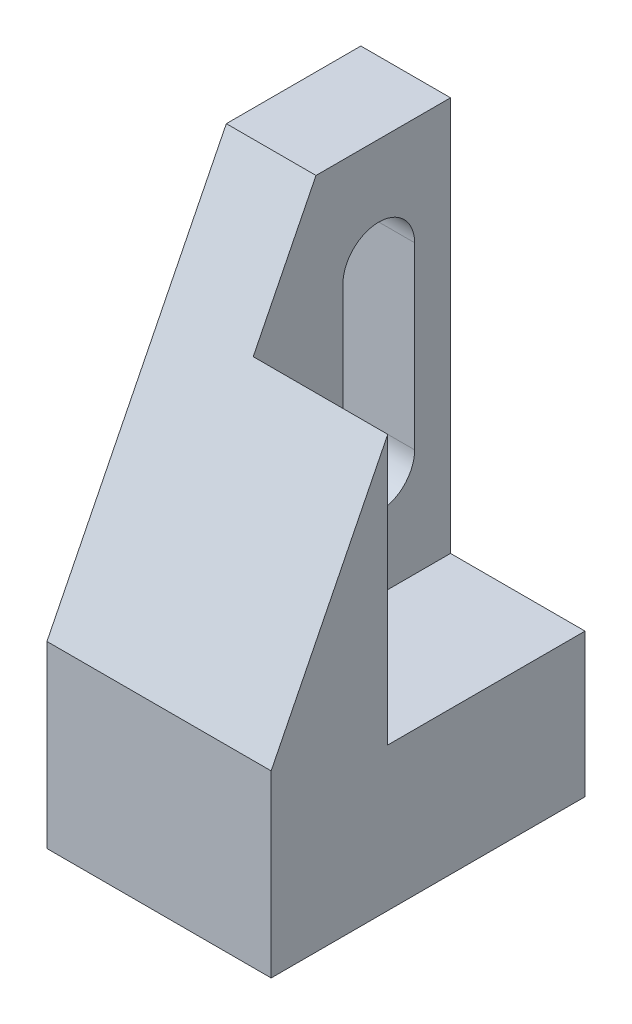
from build123d import *

# Parameters (mm, degrees)
BOSS_EXTRUDE1_DEPTH = 25
BOSS_EXTRUDE2_DEPTH = 25
CUT_EXTRUDE1_START  = 10
CUT_EXTRUDE1_DEPTH  = 15


with BuildPart() as part:
    # Sketch1 → Boss-Extrude1 (new body)
    with BuildSketch(Plane.YZ):
        Polygon((-38, 27), (-38, -8), (-22, -8), (-22, 14), (8, 14), (-18, 27), align=None)
    extrude(amount=BOSS_EXTRUDE1_DEPTH)

    # Sketch1<3> → Boss-Extrude2 (add)
    with BuildSketch(Plane.YZ):
        Polygon((-22, 14), (-22, -8), (22, -8), (22, 7), (8, 14), align=None)
        with BuildLine():
            ThreePointArc((-10, -4), (-14, 0), (-10, 4))
            Line((-10, 4), (10, 4))
            ThreePointArc((10, 4), (14, 0), (10, -4))
            Line((10, -4), (-10, -4))
        make_face(mode=Mode.SUBTRACT)
    extrude(amount=BOSS_EXTRUDE2_DEPTH)

    # Sketch1<4> → Cut-Extrude1 (cut)
    with BuildSketch(Plane.YZ.offset(CUT_EXTRUDE1_START)):
        Polygon((-22, 14), (-22, -8), (22, -8), (22, 7), (8, 14), align=None)
        with BuildLine():
            ThreePointArc((-10, -4), (-14, 0), (-10, 4))
            Line((-10, 4), (10, 4))
            ThreePointArc((10, 4), (14, 0), (10, -4))
            Line((10, -4), (-10, -4))
        make_face(mode=Mode.SUBTRACT)
    extrude(amount=CUT_EXTRUDE1_DEPTH, mode=Mode.SUBTRACT)


solid = part.part
